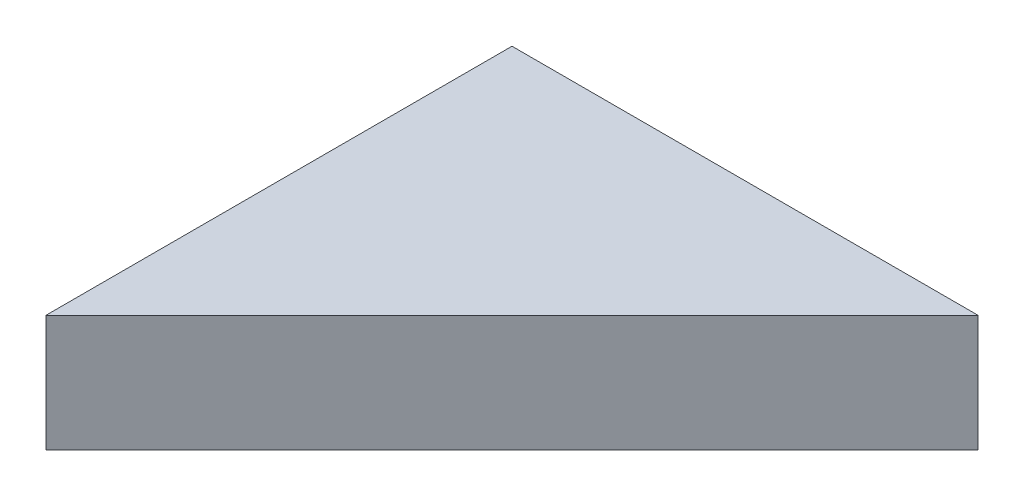
from build123d import *

# Parameters (mm, degrees)
BOSS_EXTRUDE1_DEPTH = 15


with BuildPart() as part:
    # Sketch1 → Boss-Extrude1 (new body)
    with BuildSketch(Plane(origin=(0, 0, 0), x_dir=(1, 0, 0), z_dir=(0, 1, 0))):
        Polygon((0, 0), (0, 60), (60, 60), align=None)
    extrude(amount=BOSS_EXTRUDE1_DEPTH)


solid = part.part
